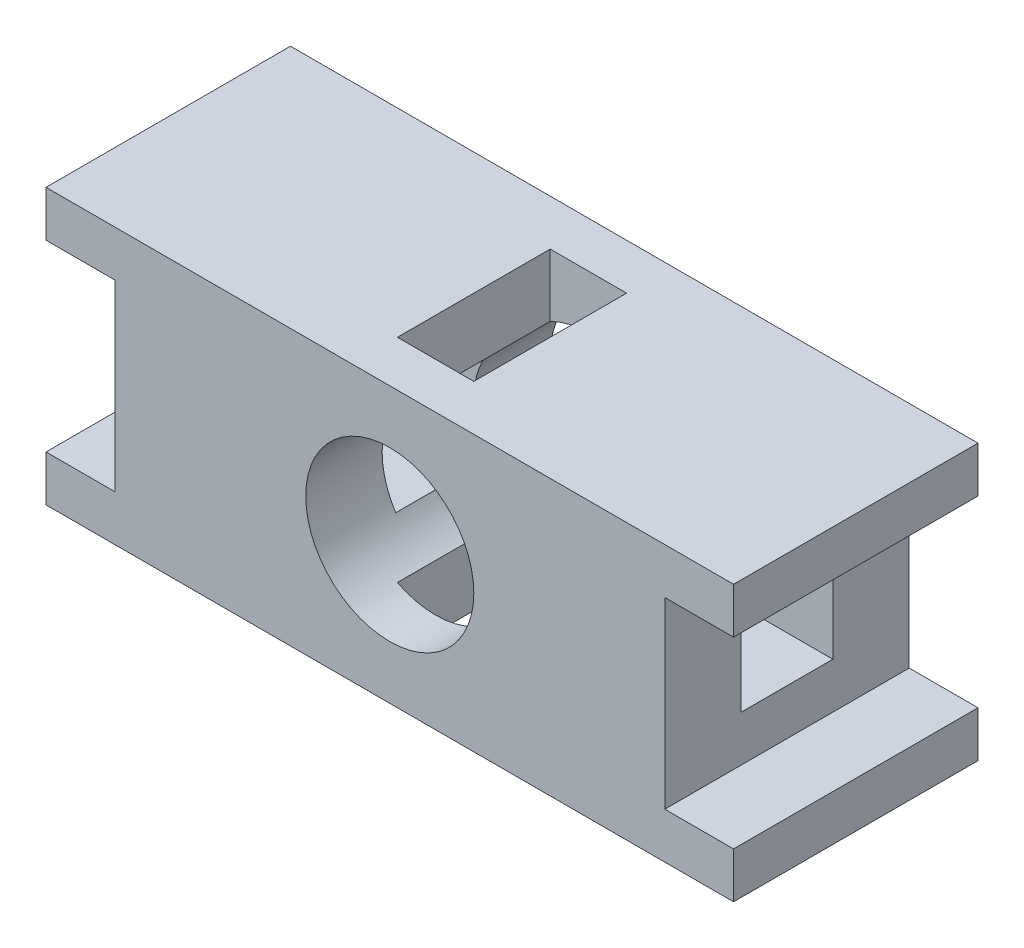
from build123d import *

# Parameters (mm, degrees)
SKETCH_2_W          = 90
SKETCH_2_H          = 36
EXTRUDE_1_DEPTH     = 32
SKETCH_3_W          = 9
SKETCH_3_H          = 24
CUT_EXTRUDE_1_DEPTH = 59.077534383
SKETCH_4_W          = 9
SKETCH_4_H          = 24
CUT_EXTRUDE_2_DEPTH = 59.077534383
SKETCH_6_R          = 11
CUT_EXTRUDE_3_DEPTH = 59.077534383
SKETCH_7_W          = 10
SKETCH_7_H          = 20
CUT_EXTRUDE_4_DEPTH = 66.916613991
SKETCH_9_W          = 12
SKETCH_9_H          = 12
CUT_EXTRUDE_5_DEPTH = 89.932558717


with BuildPart() as part:
    # Эскиз2 → Бобышка-Вытянуть1 (new body)
    with BuildSketch(Plane.XY):
        Rectangle(SKETCH_2_W, SKETCH_2_H)
    extrude(amount=EXTRUDE_1_DEPTH)

    # Эскиз3 → Вырез-Вытянуть1 (cut, through all)
    with BuildSketch(Plane.XY.offset(32)):
        with Locations((-40.5, 0)):
            Rectangle(SKETCH_3_W, SKETCH_3_H)
    extrude(amount=-CUT_EXTRUDE_1_DEPTH, mode=Mode.SUBTRACT)

    # Эскиз4 → Вырез-Вытянуть2 (cut, through all)
    with BuildSketch(Plane.XY.offset(32)):
        with Locations((40.5, 0)):
            Rectangle(SKETCH_4_W, SKETCH_4_H)
    extrude(amount=-CUT_EXTRUDE_2_DEPTH, mode=Mode.SUBTRACT)

    # Эскиз6 → Вырез-Вытянуть3 (cut, through all)
    with BuildSketch(Plane.XY.offset(32)):
        Circle(SKETCH_6_R)
    extrude(amount=-CUT_EXTRUDE_3_DEPTH, mode=Mode.SUBTRACT)

    # Эскиз7 → Вырез-Вытянуть4 (cut, through all)
    with BuildSketch(Plane(origin=(0, 18, 0), x_dir=(1, 0, 0), z_dir=(0, 1, 0))):
        with Locations((0, -16)):
            Rectangle(SKETCH_7_W, SKETCH_7_H)
    extrude(amount=-CUT_EXTRUDE_4_DEPTH, mode=Mode.SUBTRACT)

    # Эскиз9 → Вырез-Вытянуть5 (cut, through all)
    with BuildSketch(Plane.ZY.offset(36)):
        with Locations((16, 0)):
            Rectangle(SKETCH_9_W, SKETCH_9_H)
    extrude(amount=-CUT_EXTRUDE_5_DEPTH, mode=Mode.SUBTRACT)


solid = part.part
